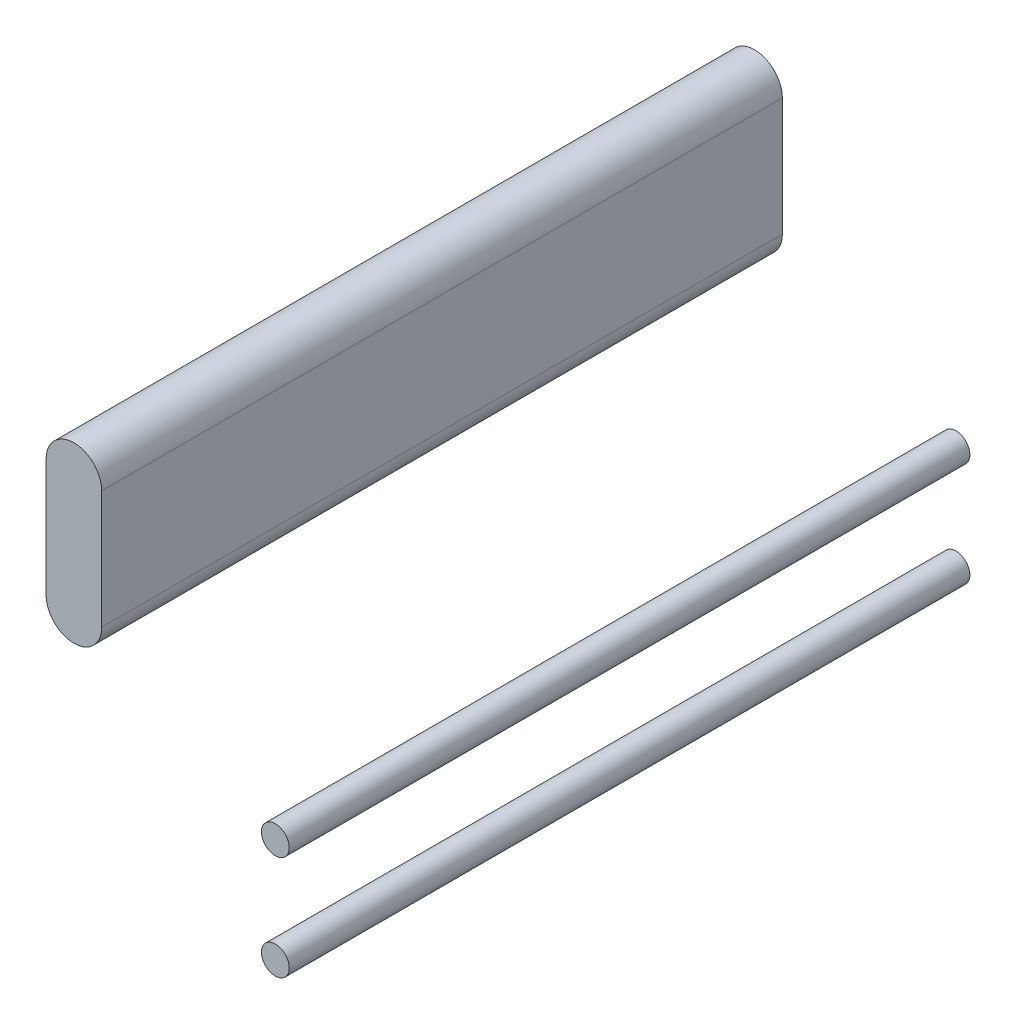
from build123d import *

# Parameters (mm, degrees)
SKETCH2_R             = 2
BOSS_EXTRUDE1_DEPTH   = 98
BOSS_EXTRUDE1_2_DEPTH = 98
BOSS_EXTRUDE1_3_DEPTH = 98


with BuildPart() as part:
    # Sketch2 → Boss-Extrude1 (new body)
    with BuildSketch(Plane.XY):
        with Locations((29, -9)):
            Circle(SKETCH2_R)
    extrude(amount=BOSS_EXTRUDE1_DEPTH)


with BuildPart() as body_2:
    # Sketch2 → Boss-Extrude1 2 (new body)
    with BuildSketch(Plane.XY):
        with Locations((29, -24)):
            Circle(SKETCH2_R)
    extrude(amount=BOSS_EXTRUDE1_2_DEPTH)


with BuildPart() as body_3:
    # Sketch2 → Boss-Extrude1 3 (new body)
    with BuildSketch(Plane.XY):
        with BuildLine():
            Line((4, 5), (4, 22))
            ThreePointArc((4, 22), (0, 26), (-4, 22))
            Line((-4, 22), (-4, 5))
            ThreePointArc((-4, 5), (0, 1), (4, 5))
        make_face()
    extrude(amount=BOSS_EXTRUDE1_3_DEPTH)


solid = Compound([part.part, body_2.part, body_3.part])
